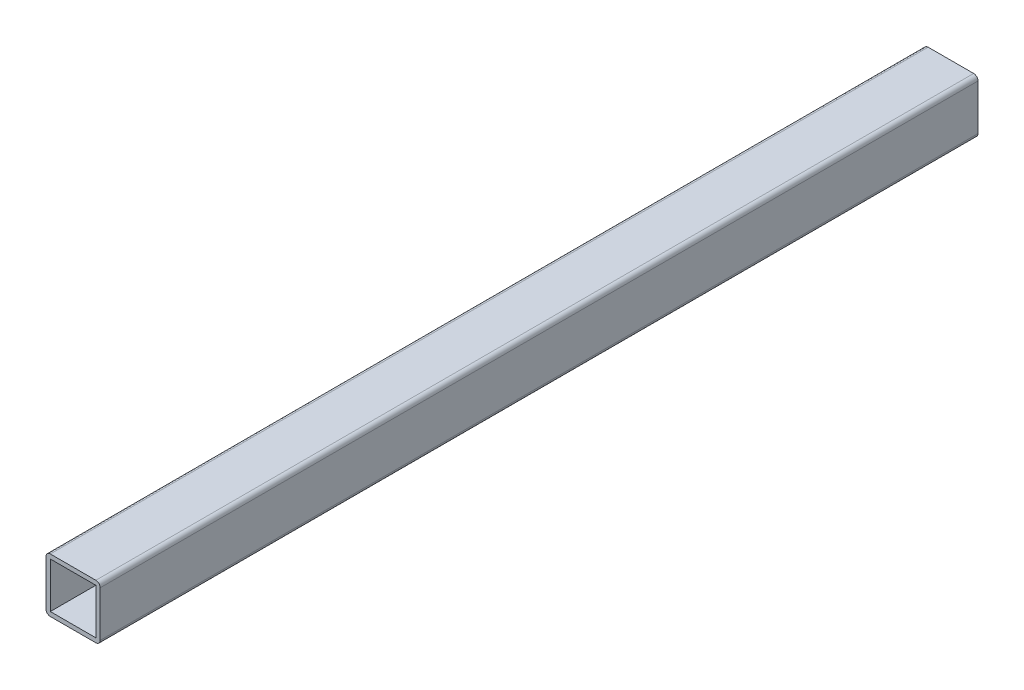
from build123d import *

# Parameters (mm, degrees)
SKETCH_1_W      = 42
SKETCH_1_H      = 42
EXTRUDE_1_DEPTH = 810


with BuildPart() as part:
    # Эскиз1 → Бобышка-Вытянуть1 (new body)
    with BuildSketch(Plane.XY):
        with BuildLine():
            Line((4, 0), (46, 0))
            ThreePointArc((46, 0), (48.828427125, 1.171572875), (50, 4))
            Line((50, 4), (50, 46))
            ThreePointArc((50, 46), (48.828427125, 48.828427125), (46, 50))
            Line((46, 50), (4, 50))
            ThreePointArc((4, 50), (1.171572875, 48.828427125), (0, 46))
            Line((0, 46), (0, 4))
            ThreePointArc((0, 4), (1.171572875, 1.171572875), (4, 0))
        make_face()
        with Locations((25, 25)):
            Rectangle(SKETCH_1_W, SKETCH_1_H, mode=Mode.SUBTRACT)
    extrude(amount=EXTRUDE_1_DEPTH)


solid = part.part
